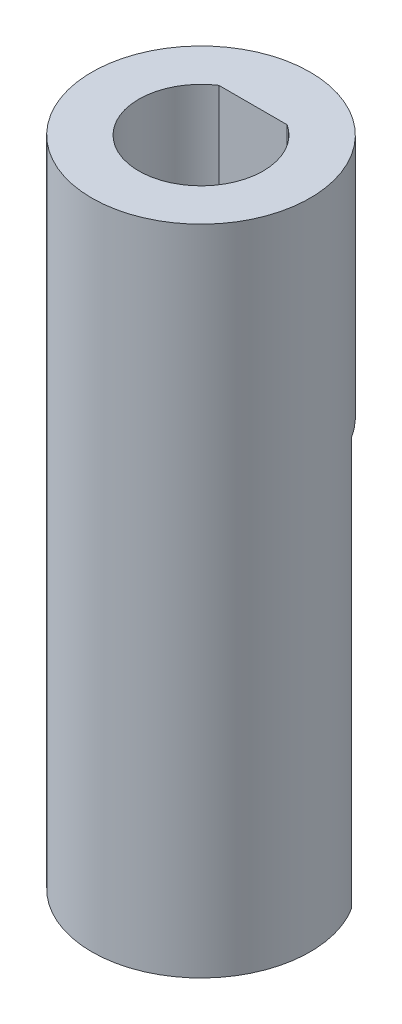
from build123d import *

# Parameters (mm, degrees)
IZIM1_R                     = 2.2
Y_KSEKLIK_EKSTR_ZYON1_DEPTH = 20
IZIM2_R                     = 5.35
IZIM2_R_2                   = 2.2
Y_KSEKLIK_EKSTR_ZYON2_DEPTH = 12
KES_EKSTR_ZYON1_DEPTH       = 10


with BuildPart() as part:
    # Çizim1 → Yükseklik-Ekstrüzyon1 (new body)
    with BuildSketch(Plane(origin=(0, 0, 0), x_dir=(1, 0, 0), z_dir=(0, 1, 0))):
        with BuildLine():
            Line((-4.527692569, 2.85), (4.527692569, 2.85))
            ThreePointArc((4.527692569, 2.85), (0, -5.35), (-4.527692569, 2.85))
        make_face()
        with Locations(Location((0, 0, 0), (0, 0, 270))):
            Circle(IZIM1_R, mode=Mode.SUBTRACT)
    extrude(amount=Y_KSEKLIK_EKSTR_ZYON1_DEPTH)

    # Çizim2 → Yükseklik-Ekstrüzyon2 (add)
    with BuildSketch(Plane(origin=(0, 20, 0), x_dir=(1, 0, 0), z_dir=(0, 1, 0))):
        with Locations(Location((0, 0, 0), (0, 0, 32.188761118))):
            Circle(IZIM2_R)
        with Locations(Location((0, 0, 0), (0, 0, 270))):
            Circle(IZIM2_R_2, mode=Mode.SUBTRACT)
    extrude(amount=Y_KSEKLIK_EKSTR_ZYON2_DEPTH)

    # Çizim3 → Kes-Ekstrüzyon1 (cut)
    with BuildSketch(Plane(origin=(0, 32, 0), x_dir=(1, 0, 0), z_dir=(0, 1, 0))):
        with BuildLine():
            Line((-1.673320053, 2.55), (1.673320053, 2.55))
            ThreePointArc((1.673320053, 2.55), (0, -3.05), (-1.673320053, 2.55))
        make_face()
    extrude(amount=-KES_EKSTR_ZYON1_DEPTH, mode=Mode.SUBTRACT)


solid = part.part
